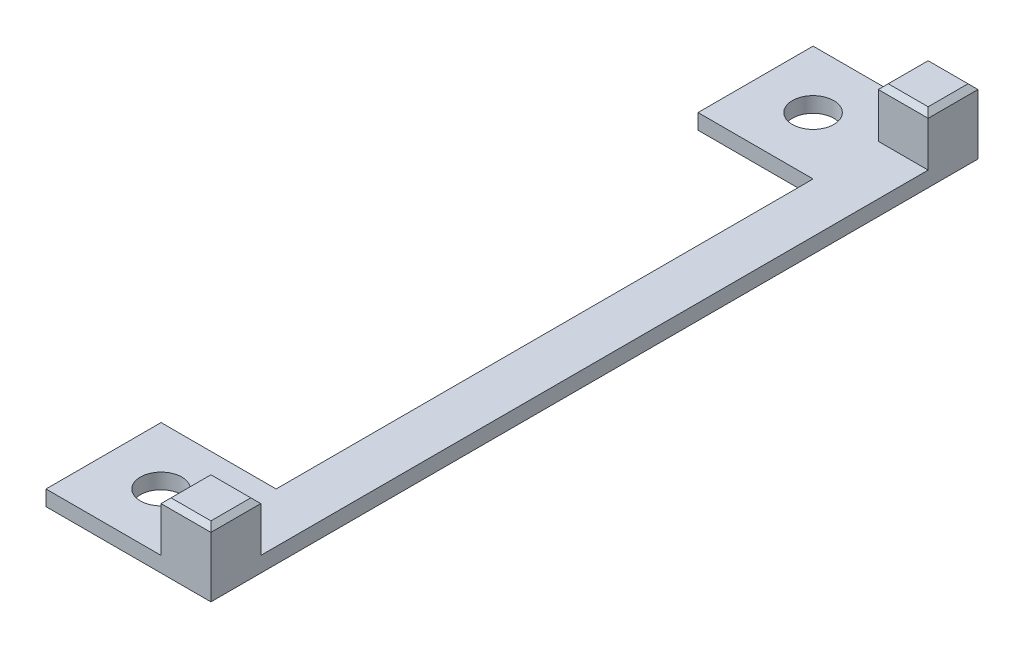
from build123d import *

# Parameters (mm, degrees)
SKETCH2_W           = 6.5
SKETCH2_H           = 6.5
BOSS_EXTRUDE1_DEPTH = 8.5
SKETCH4_W           = 15
SKETCH4_H           = 2
BOSS_EXTRUDE2_DEPTH = 15
SKETCH5_R           = 2.7
CUT_EXTRUDE1_DEPTH  = 23.774998804
SKETCH6_W           = 6.5
SKETCH6_H           = 87
BOSS_EXTRUDE3_DEPTH = 2
CUT_EXTRUDE3_DEPTH  = 103.034534305
CUT_EXTRUDE4_DEPTH  = 99.257059971
CUT_EXTRUDE5_DEPTH  = 99.257059971
CUT_EXTRUDE6_DEPTH  = 99.257059971
CUT_EXTRUDE7_DEPTH  = 103.034534305


with BuildPart() as part:
    # Sketch2 → Boss-Extrude1 (new body)
    with BuildSketch(Plane(origin=(0, 0, 0), x_dir=(1, 0, 0), z_dir=(0, 1, 0))):
        with Locations((-0.156417112, 0.017379679)):
            Rectangle(SKETCH2_W, SKETCH2_H)
    extrude(amount=BOSS_EXTRUDE1_DEPTH)

    # Sketch4 → Boss-Extrude2 (add)
    with BuildSketch(Plane.ZY.offset(3.406417112)):
        with Locations((4.232620321, 1)):
            Rectangle(SKETCH4_W, SKETCH4_H)
    extrude(amount=BOSS_EXTRUDE2_DEPTH)

    # Sketch5 → Cut-Extrude1 (cut, through all)
    with BuildSketch(Plane(origin=(0, 2, 0), x_dir=(1, 0, 0), z_dir=(0, 1, 0))):
        with Locations(Location((-10.906417112, -4.232620321, 0), (0, 0, 270))):
            Circle(SKETCH5_R)
    extrude(amount=-CUT_EXTRUDE1_DEPTH, mode=Mode.SUBTRACT)


with BuildPart() as body_2:
    # Mirror3: mirrored copy
    add(part.part.mirror(Plane(origin=(-18.406417112, 0, 11.732620321), x_dir=(1, 0, 0), z_dir=(0, 0, -1))))


with BuildPart() as body_2_1:
    # Body-Move/Copy3: moved
    add(body_2.part.moved(Location((0, 0, 70))))


with BuildPart() as part_1:
    add(part.part)

    add(body_2_1.part)  # Boss-Extrude3 merges body 2
    # Sketch6 → Boss-Extrude3 (add)
    with BuildSketch(Plane(origin=(0, 0, 0), x_dir=(1, 0, 0), z_dir=(0, 1, 0))):
        with Locations((-0.156417112, -46.732620321)):
            Rectangle(SKETCH6_W, SKETCH6_H)
    extrude(amount=BOSS_EXTRUDE3_DEPTH)

    # Sketch10 → Cut-Extrude3 (cut, through all)
    with BuildSketch(Plane(origin=(0, 0, -3.267379679), x_dir=(-1, 0, 0), z_dir=(0, 0, -1))):
        Polygon((-2.443582888, 8.5), (-3.093582888, 7.85), (-3.093582888, 8.5), align=None)
    extrude(amount=-CUT_EXTRUDE3_DEPTH, mode=Mode.SUBTRACT)

    # Sketch7 → Cut-Extrude4 (cut, through all)
    with BuildSketch(Plane.ZY.offset(3.406417112)):
        Polygon((2.582620321, 8.5), (3.232620321, 7.85), (3.232620321, 8.5), align=None)
    extrude(amount=-CUT_EXTRUDE4_DEPTH, mode=Mode.SUBTRACT)

    # Sketch12 → Cut-Extrude5 (cut, through all)
    with BuildSketch(Plane.ZY.offset(3.406417112)):
        Polygon((-2.617379679, 8.5), (-3.267379679, 7.85), (-3.267379679, 8.5), align=None)
    extrude(amount=-CUT_EXTRUDE5_DEPTH, mode=Mode.SUBTRACT)

    # Sketch13 → Cut-Extrude6 (cut, through all)
    with BuildSketch(Plane.ZY.offset(3.406417112)):
        Polygon((90.882620321, 8.5), (90.232620321, 7.85), (90.232620321, 8.5), align=None)
        Polygon((96.082620321, 8.5), (96.732620321, 7.85), (96.732620321, 8.5), align=None)
    extrude(amount=-CUT_EXTRUDE6_DEPTH, mode=Mode.SUBTRACT)

    # Sketch11 → Cut-Extrude7 (cut, through all)
    with BuildSketch(Plane(origin=(0, 0, -3.267379679), x_dir=(-1, 0, 0), z_dir=(0, 0, -1))):
        Polygon((2.756417112, 8.5), (3.406417112, 7.85), (3.406417112, 8.5), align=None)
    extrude(amount=-CUT_EXTRUDE7_DEPTH, mode=Mode.SUBTRACT)


solid = part_1.part
